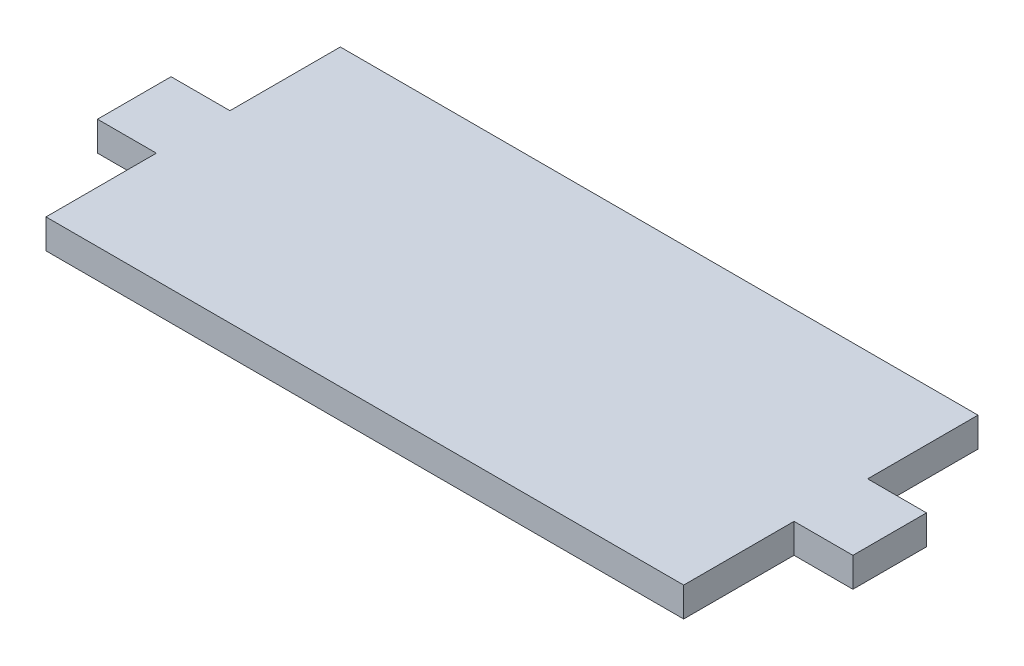
from build123d import *

# Parameters (mm, degrees)
GRUNDPLATTE_DEPTH = 6


with BuildPart() as part:
    # Skizze1 → Grundplatte (new body)
    with BuildSketch(Plane(origin=(0, 0, 0), x_dir=(1, 0, 0), z_dir=(0, 1, 0))):
        Polygon((65, 30), (-65, 30), (-65, 7.5), (-77, 7.5), (-77, -7.5), (-65, -7.5), (-65, -30), (65, -30), (65, -7.5), (77, -7.5), (77, 7.5), (65, 7.5), align=None)
    extrude(amount=GRUNDPLATTE_DEPTH)


solid = part.part
